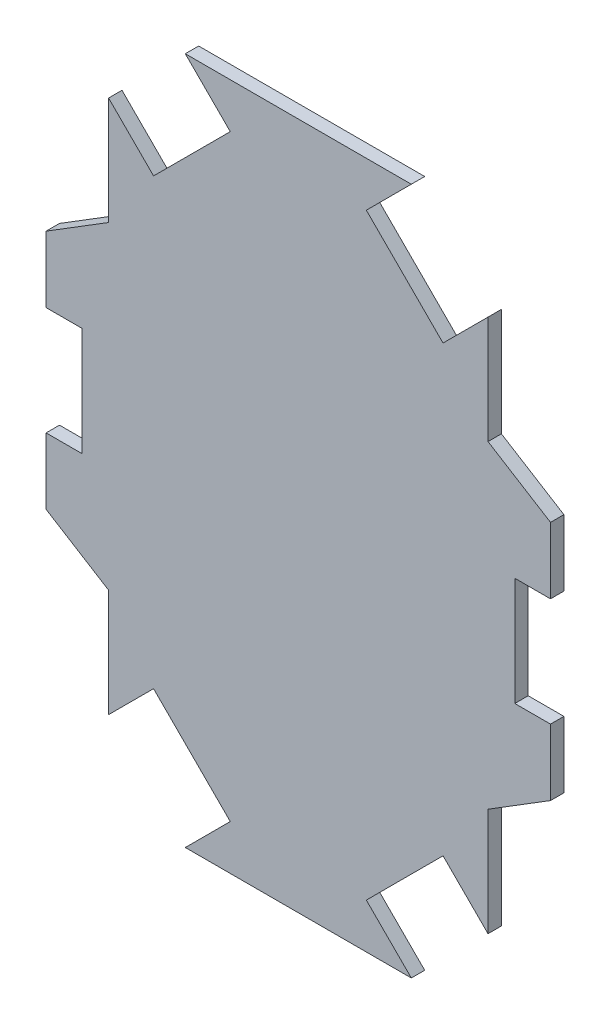
from build123d import *

# Parameters (mm, degrees)
SKETCH_1_W          = 85
SKETCH_1_H          = 154
EXTRUDE_1_DEPTH     = 3
CUT_EXTRUDE_2_DEPTH = 58
EXTRUDE_2_DEPTH     = 3
SKETCH_4_W          = 44.4
SKETCH_4_H          = 24.3
CUT_EXTRUDE_3_DEPTH = 58


with BuildPart() as part:
    # 草图1 → 凸台-拉伸1 (new body)
    with BuildSketch(Plane.XY):
        with Locations((42.5, -77)):
            Rectangle(SKETCH_1_W, SKETCH_1_H)
    extrude(amount=EXTRUDE_1_DEPTH)

    # 草图2 → 切除-拉伸2 (cut)
    with BuildSketch(Plane.XY.offset(3)):
        Polygon((10.076271632, -27.258966415), (-21.319269453, 4.13657467), (-4.13657467, 21.319269453), (27.258966415, -10.076271632), align=None)
        Polygon((-21.319269453, -158.13657467), (-4.13657467, -175.319269453), (27.258966415, -143.923728368), (10.076271632, -126.741033585), align=None)
        Polygon((74.923728368, -126.741033585), (106.319269453, -158.13657467), (89.13657467, -175.319269453), (57.741033585, -143.923728368), align=None)
        Polygon((74.923728368, -27.258966415), (57.741033585, -10.076271632), (89.13657467, 21.319269453), (106.319269453, 4.13657467), align=None)
        Polygon((85, -41.334617867), (99, -50.011428212), (99, -103.988571788), (85, -112.665382133), align=None)
        Polygon((0, -41.334617867), (-14, -50.011428212), (-14, -103.988571788), (0, -112.665382133), align=None)
    extrude(amount=-CUT_EXTRUDE_2_DEPTH, mode=Mode.SUBTRACT)

    # 草图3 → 凸台-拉伸2 (add)
    with BuildSketch(Plane.XY.offset(3)):
        Polygon((85, -41.334617867), (99, -50.011428212), (99, -103.988571788), (85, -112.665382133), align=None)
        Polygon((-14, -103.988571788), (0, -112.665382133), (0, -41.334617867), (-14, -50.011428212), align=None)
    extrude(amount=-EXTRUDE_2_DEPTH)

    # 草图4 → 切除-拉伸3 (cut)
    with BuildSketch(Plane.XY.offset(3)):
        with Locations((113.2, -77)):
            Rectangle(SKETCH_4_W, SKETCH_4_H)
        with Locations((-28.2, -77)):
            Rectangle(SKETCH_4_W, SKETCH_4_H)
    extrude(amount=-CUT_EXTRUDE_3_DEPTH, mode=Mode.SUBTRACT)


solid = part.part
